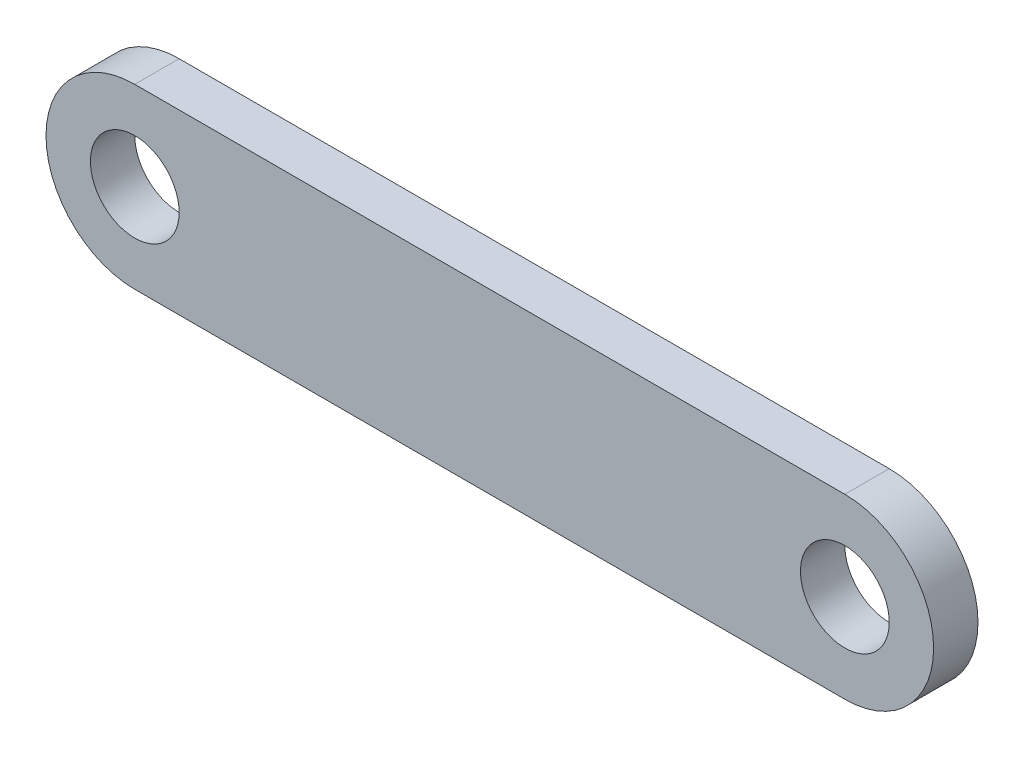
from build123d import *

# Parameters (mm, degrees)
SKETCH1_R           = 2
BOSS_EXTRUDE1_DEPTH = 1


with BuildPart() as part:
    # Sketch1 → Boss-Extrude1 (new, symmetric)
    with BuildSketch(Plane.XY):
        with BuildLine():
            Line((0, 4), (32, 4))
            ThreePointArc((32, 4), (36, 0), (32, -4))
            Line((32, -4), (0, -4))
            ThreePointArc((0, -4), (-4, 0), (0, 4))
        make_face()
        Circle(SKETCH1_R, mode=Mode.SUBTRACT)
        with Locations((32, 0)):
            Circle(SKETCH1_R, mode=Mode.SUBTRACT)
    extrude(amount=BOSS_EXTRUDE1_DEPTH, both=True)


solid = part.part
